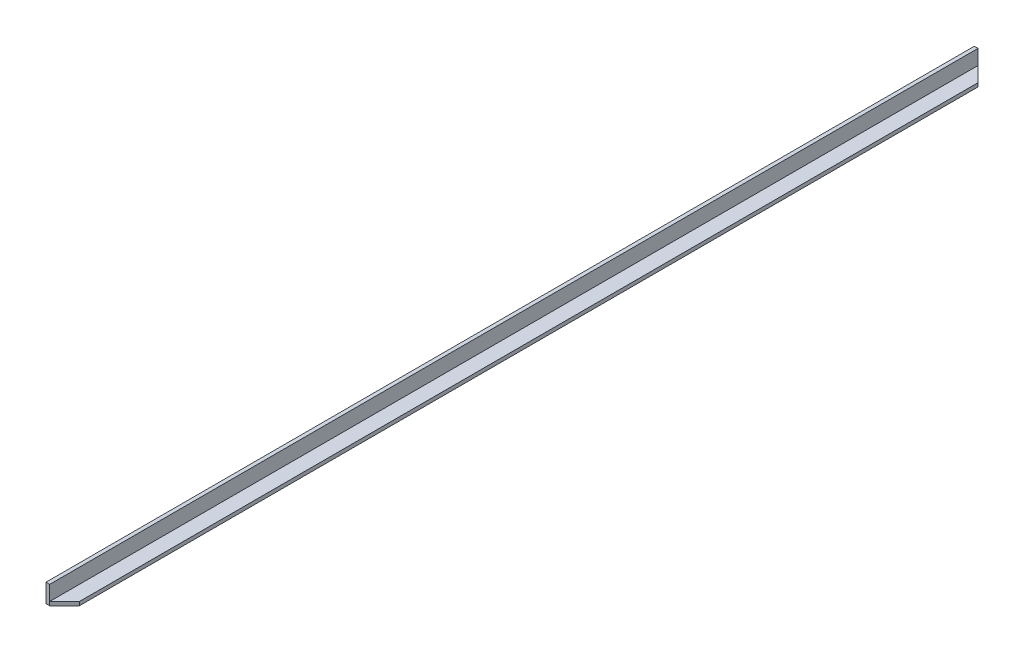
from build123d import *

# Parameters (mm, degrees)
EXTRUDE_1_DEPTH     = 1000
CUT_EXTRUDE_1_DEPTH = 1001.177984161
CUT_EXTRUDE_2_DEPTH = 1001.177984161


with BuildPart() as part:
    # Эскиз1 → Бобышка-Вытянуть1 (new body)
    with BuildSketch(Plane.XY):
        Polygon((-10, 0), (10, 0), (10, 4), (-6, 4), (-6, 20), (-10, 20), align=None)
    extrude(amount=EXTRUDE_1_DEPTH)

    # Эскиз2 → Вырез-Вытянуть1 (cut, through all)
    with BuildSketch(Plane(origin=(0, 4, 0), x_dir=(1, 0, 0), z_dir=(0, 1, 0))):
        Polygon((-6, 0), (10, -16), (10, 0), align=None)
    extrude(amount=-CUT_EXTRUDE_1_DEPTH, mode=Mode.SUBTRACT)

    # Эскиз3 → Вырез-Вытянуть2 (cut, through all)
    with BuildSketch(Plane(origin=(0, 4, 0), x_dir=(1, 0, 0), z_dir=(0, 1, 0))):
        Polygon((-6, -1000), (10, -984), (10, -1000), align=None)
    extrude(amount=-CUT_EXTRUDE_2_DEPTH, mode=Mode.SUBTRACT)


solid = part.part
